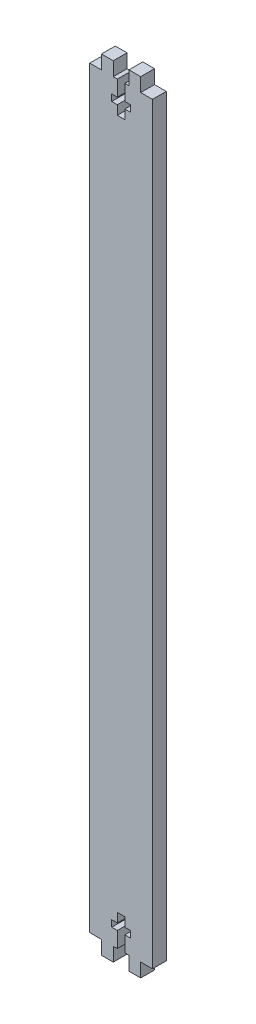
from build123d import *

# Parameters (mm, degrees)
SKETCH2_W           = 25.4
SKETCH2_H           = 315.976
BOSS_EXTRUDE1_DEPTH = 5.588
SKETCH3_W           = 4.7625
SKETCH3_H           = 5.588
SKETCH3_W_2         = 6.35
CUT_EXTRUDE2_DEPTH  = 159.596103004
CUT_EXTRUDE4_DEPTH  = 159.596103004


with BuildPart() as part:
    # Sketch2 → Boss-Extrude1 (new body)
    with BuildSketch(Plane.XY):
        Rectangle(SKETCH2_W, SKETCH2_H)
    extrude(amount=BOSS_EXTRUDE1_DEPTH)

    # Sketch3 → Cut-Extrude2 (cut, through all)
    with BuildSketch(Plane.XY):
        with Locations((-10.31875, -155.194)):
            Rectangle(SKETCH3_W, SKETCH3_H)
        with Locations((10.31875, -155.194)):
            Rectangle(SKETCH3_W, SKETCH3_H)
        with Locations((0, -155.194)):
            Rectangle(SKETCH3_W_2, SKETCH3_H)
        with Locations((-10.31875, 155.194)):
            Rectangle(SKETCH3_W, SKETCH3_H)
        with Locations((10.31875, 155.194)):
            Rectangle(SKETCH3_W, SKETCH3_H)
        with Locations((0, 155.194)):
            Rectangle(SKETCH3_W_2, SKETCH3_H)
    extrude(amount=CUT_EXTRUDE2_DEPTH, mode=Mode.SUBTRACT)

    # Sketch4 → Cut-Extrude4 (cut, through all)
    with BuildSketch(Plane.XY):
        Polygon((-1.525, -152.4), (1.525, -152.4), (1.525, -146.05), (3.79, -146.05), (3.79, -143.42), (1.525, -143.42), (1.525, -139.7), (-1.525, -139.7), (-1.525, -143.42), (-3.79, -143.42), (-3.79, -146.05), (-1.525, -146.05), align=None)
    cut_extrude4 = extrude(amount=CUT_EXTRUDE4_DEPTH, mode=Mode.SUBTRACT)

    # Mirror1: Cut-Extrude4 across plane
    add(cut_extrude4.mirror(Plane.ZX), mode=Mode.SUBTRACT)


solid = part.part
